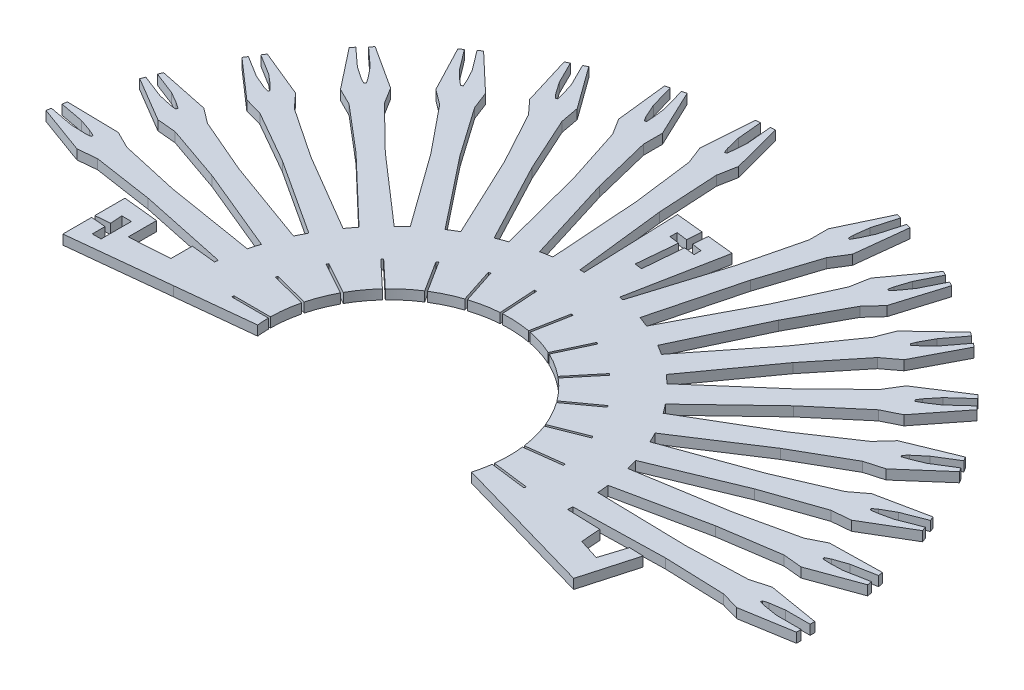
from build123d import *

# Parameters (mm, degrees)
SKETCH2_R               = 6.200163369
BOSS_EXTRUDE1_DEPTH     = 0.5
BOSS_EXTRUDE2_DEPTH     = 0.5
BOSS_EXTRUDE3_DEPTH     = 0.5
CIRPATTERN1_COUNT       = 18
CIRPATTERN1_ANGLE       = 180
CUT_EXTRUDE4_DEPTH      = 103.382941872
CUT_EXTRUDE4_DEPTH_BACK = 0.5
CUT_EXTRUDE6_DEPTH      = 103.382941872
CUT_EXTRUDE6_DEPTH_BACK = 0.5
CUT_EXTRUDE13_DEPTH     = 10
SKETCH13_R              = 2.29112386
SKETCH13_W              = 5.561420579
SKETCH13_H              = 0.106651934
CUT_EXTRUDE14_DEPTH     = 103.382941872


with BuildPart() as part:
    # Sketch2 → Boss-Extrude1 (new body)
    with BuildSketch(Plane(origin=(0, 0, 0), x_dir=(1, 0, 0), z_dir=(0, 1, 0))):
        with BuildLine():
            Line((41.736564116, 50.95828476), (36.555246465, 51.501399508))
            Line((36.555246465, 51.501399508), (36.555246465, 48.286890075))
            Line((36.555246465, 48.286890075), (41.732722408, 48.833722572))
            ThreePointArc((41.732722408, 48.833722572), (41.733244647, 48.828783324), (41.733769301, 48.82384433))
            ThreePointArc((41.733769301, 48.82384433), (50.963390645, 39.773597615), (61.612393233, 47.101054176))
            Line((61.612393233, 47.101054176), (66.500703475, 45.70083261))
            Line((66.500703475, 45.70083261), (67.011967053, 48.840095645))
            Line((67.011967053, 48.840095645), (61.960868148, 49.001189769))
            ThreePointArc((61.960868148, 49.001189769), (59.963353335, 56.003029367), (53.794021492, 59.87022057))
            Line((53.794021492, 59.87022057), (54.740102943, 64.742398272))
            Line((54.740102943, 64.742398272), (51.585987879, 65.064191003))
            Line((51.585987879, 65.064191003), (51.764987526, 60.059419928))
            ThreePointArc((51.764987526, 60.059419928), (45.016500937, 57.426340658), (41.737479755, 50.966991019))
            ThreePointArc((41.737479755, 50.966991019), (41.737020998, 50.962637988), (41.736564116, 50.95828476))
        make_face()
        with Locations(Location((51.841, 49.9, 0), (0, 0, 270))):
            Circle(SKETCH2_R, mode=Mode.SUBTRACT)
    extrude(amount=BOSS_EXTRUDE1_DEPTH)

    # Sketch3 → Boss-Extrude2 (add)
    with BuildSketch(Plane(origin=(0, 0, 0), x_dir=(1, 0, 0), z_dir=(0, 1, 0))):
        Polygon((32.227287846, 50.031148161), (31.574301661, 50.133558432), (30.299517244, 50.133558432), (30.299517244, 50.375597256), (32.947654716, 50.817304866), (33.894871846, 50.546841292), (37.005755545, 50.436065261), (41.857469478, 50.546841292), (41.857469478, 49.253158708), (37.005755545, 49.363934739), (33.894871846, 49.253158708), (32.947654716, 48.982695134), (30.299517244, 49.424402744), (30.299517244, 49.666441568), (31.574301661, 49.666441568), (32.323022544, 49.778206625), (32.588103044, 49.852616566), (32.588103044, 49.947383434), align=None)
    boss_extrude2 = extrude(amount=BOSS_EXTRUDE2_DEPTH)

    # CirPattern1: Boss-Extrude2 ×18 about axis
    cirpattern1_axis = Axis((51.841, 0, -49.9), (0, -1, 0))
    for i in range(1, CIRPATTERN1_COUNT):
        add(boss_extrude2.rotate(cirpattern1_axis, i * CIRPATTERN1_ANGLE / (CIRPATTERN1_COUNT - 1)))

    # Sketch8 → Cut-Extrude4 (cut, two sides: drawn at the far end of the back side and taken through both)
    with BuildSketch(Plane(origin=(0, 0, 0), x_dir=(1, 0, 0), z_dir=(0, 1, 0)).offset(-CUT_EXTRUDE4_DEPTH_BACK)):
        Polygon((36.555246465, 48.286890075), (27.995570216, 47.169676763), (27.995570216, 52.890741223), (36.555246465, 51.501399508), (36.555246465, 48.753981284), align=None)
        Polygon((51.655565612, 72.526598057), (51.585987879, 65.064191003), (54.740102943, 64.742398272), (56.406958129, 72.526598057), align=None)
        Polygon((47.95502979, 51.501399508), (46.998338953, 48.798), (52.839188276, 46.161429513), (54.740102943, 51.719098387), align=None)
    extrude(amount=CUT_EXTRUDE4_DEPTH + CUT_EXTRUDE4_DEPTH_BACK, mode=Mode.SUBTRACT)


with BuildPart() as body_2:
    # Sketch5 → Boss-Extrude3 (new body)
    with BuildSketch(Plane(origin=(0, 0, 0), x_dir=(1, 0, 0), z_dir=(0, 1, 0))):
        Polygon((51.841, 49.9), (51.841, 47.98601508), (47.518666367, 49.9), align=None)
    extrude(amount=BOSS_EXTRUDE3_DEPTH)


with BuildPart() as cut_extrude6_tool:
    # Sketch9 → Cut-Extrude6 (new, two sides: drawn at the far end of the back side and taken through both)
    with BuildSketch(Plane(origin=(0, 0, 0), x_dir=(1, 0, 0), z_dir=(0, 1, 0)).offset(-CUT_EXTRUDE6_DEPTH_BACK)):
        Polygon((36.555246465, 48.286890075), (47.009139853, 49.390092422), (47.587964148, 50.49093808), (51.841, 49.9), (66.500703475, 45.70083261), (51.841, 34.857894493), align=None)
    extrude(amount=CUT_EXTRUDE6_DEPTH + CUT_EXTRUDE6_DEPTH_BACK)


with BuildPart() as part_1:
    add(part.part)

    # Cut-Extrude6: cut by cut_extrude6_tool
    add(cut_extrude6_tool.part, mode=Mode.SUBTRACT)

    # Sketch12 → Cut-Extrude13 (cut)
    with BuildSketch(Plane(origin=(0, 0, 0), x_dir=(1, 0, 0), z_dir=(0, 1, 0))):
        Polygon((36.555246465, 51.501399508), (38.377437868, 51.501399508), (38.377437868, 49.846380566), (40.450129226, 49.985069668), (40.450129226, 51.16915959), (37.317153392, 51.720562063), align=None)
        Polygon((66.036768105, 49.006664529), (65.095153252, 45.671159721), (66.958125451, 45.145241638), (67.462296373, 48.891444034), align=None)
        Polygon((53.08254989, 66.12808357), (52.948117152, 64.171821775), (52.385771098, 64.24300482), (52.385771098, 63.878888302), (52.896048123, 63.814296274), (52.708350835, 61.754583122), (53.087715457, 61.700660527), (53.262410471, 63.755183921), (53.814395603, 63.698049757), (53.814395603, 64.054600552), (53.300329713, 64.12534266), (53.473842648, 66.014949594), align=None)
        Polygon((65.273932949, 48.895526569), (64.858820111, 47.588272269), (63.761063297, 47.936860104), (63.677982038, 49.064928372), (65.504842158, 49.006664529), align=None)
        Polygon((35.431152546, 49.858633501), (37.312510157, 49.997193872), (37.266298078, 50.624656446), (37.766087028, 50.624656446), (37.766087028, 49.051172586), (37.312510157, 49.051172586), (37.312510157, 49.715786798), align=None)
    extrude(amount=CUT_EXTRUDE13_DEPTH, mode=Mode.SUBTRACT)

    # Sketch13 → Cut-Extrude14 (cut, through all)
    with BuildSketch(Plane(origin=(0, 0, 0), x_dir=(1, 0, 0), z_dir=(0, 1, 0))):
        with Locations((51.841102424, 49.89933139)):
            Circle(SKETCH13_R)
        Polygon((49.373582939, 50.469956344), (43.986884615, 51.853025401), (44.013407872, 51.956326668), (49.400106197, 50.573257612), align=None)
        with Locations((46.528485657, 49.891707937)):
            Rectangle(SKETCH13_W, SKETCH13_H)
        Polygon((49.593013257, 51.065676254), (44.719503253, 53.744911051), (44.770883214, 53.838370853), (49.644393218, 51.159136056), align=None)
        Polygon((49.953699285, 51.588110427), (45.899598159, 55.395164789), (45.972606432, 55.472910703), (50.026707557, 51.665856341), align=None)
        Polygon((50.432977793, 52.004432402), (47.453019629, 56.700095102), (47.543068835, 56.757242065), (50.523026999, 52.061579366), align=None)
        Polygon((51.000733951, 52.288483138), (49.282160479, 57.577708419), (49.383592496, 57.610665679), (51.102165967, 52.321440398), align=None)
        Polygon((51.62129355, 52.422414683), (51.272089063, 57.972861068), (51.378530543, 57.979557799), (51.727735031, 52.429111413), align=None)
        Polygon((52.255664549, 52.397811626), (53.297770848, 57.860724156), (53.402533683, 57.840739576), (52.360427384, 52.377827046), align=None)
        Polygon((52.863987086, 52.216219866), (55.2319248, 57.248343656), (55.328426355, 57.202933471), (52.960488641, 52.170809682), align=None)
        Polygon((53.408038017, 51.889049483), (56.953020911, 56.174197688), (57.035197638, 56.106215186), (53.490214744, 51.821066982), align=None)
        Polygon((53.853632622, 51.436857795), (58.352916383, 54.705778792), (58.415604817, 54.619495565), (53.916321056, 51.350574568), align=None)
        Polygon((54.172772553, 50.888057667), (59.343650635, 52.93535313), (59.382911831, 52.83619067), (54.212033749, 50.788895207), align=None)
        Polygon((54.345405075, 50.277132232), (59.862972191, 50.974163056), (59.876339223, 50.868352105), (54.358772106, 50.17132128), align=None)
        Polygon((54.36068305, 49.64246818), (59.878250167, 48.945437356), (59.864883135, 48.839626404), (54.347316019, 49.536657228), align=None)
        Polygon((54.217646509, 49.023943788), (59.388524591, 46.976648325), (59.349263396, 46.877485865), (54.178385314, 48.924781328), align=None)
        Polygon((53.925282963, 48.460423219), (58.424566723, 45.191502221), (58.36187829, 45.105218994), (53.862594529, 48.374139992), align=None)
        Polygon((53.501962688, 47.987314542), (57.046945581, 43.702166338), (56.964768854, 43.634183836), (53.41978596, 47.919332041), align=None)
        Polygon((52.974284454, 47.634344916), (55.342222168, 42.602221126), (55.245720613, 42.556810941), (52.877782899, 47.588934731), align=None)
        Polygon((52.375404226, 47.423692719), (53.417510525, 41.960780189), (53.31274769, 41.94079561), (52.270641391, 47.40370814), align=None)
        Polygon((51.742951851, 47.368594006), (51.393747363, 41.81814762), (51.287305883, 41.824844351), (51.63651037, 47.375290736), align=None)
        Polygon((51.116666637, 47.472510829), (49.398093165, 42.183285548), (49.296661149, 42.216242808), (51.01523462, 47.505468089), align=None)
        Polygon((50.535900388, 47.728913714), (47.555942224, 43.033251014), (47.465893018, 43.090397978), (50.445851182, 47.786060678), align=None)
        Polygon((50.037144783, 48.121691923), (45.983043657, 44.314637561), (45.910035385, 44.392383475), (49.96413651, 48.199437837), align=None)
        Polygon((49.651738471, 48.626165758), (44.778228467, 45.946930961), (44.726848506, 46.040390763), (49.60035851, 48.71962556), align=None)
        Polygon((49.403897948, 49.210637272), (44.017199624, 47.827568216), (43.990676366, 47.930869483), (49.377374691, 49.313938539), align=None)
    extrude(amount=CUT_EXTRUDE14_DEPTH, mode=Mode.SUBTRACT)


with BuildPart() as body_2_1:
    add(body_2.part)

    # Cut-Extrude6: cut by cut_extrude6_tool
    add(cut_extrude6_tool.part, mode=Mode.SUBTRACT)


solid = part_1.part
